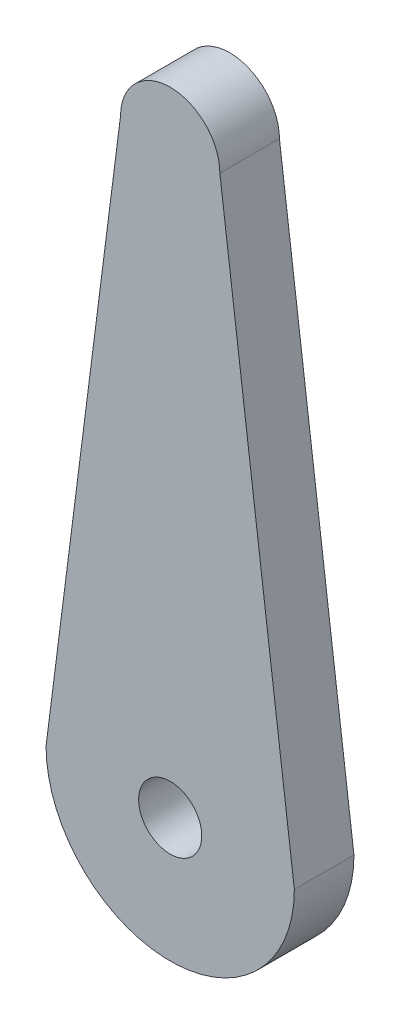
from build123d import *

# Parameters (mm, degrees)
BOSS_EXTRUDE1_DEPTH = 6
SKETCH2_R           = 3.175
CUT_EXTRUDE1_DEPTH  = 21


with BuildPart() as part:
    # Sketch1 → Boss-Extrude1 (new body)
    with BuildSketch(Plane(origin=(0, 0, 0), x_dir=(0, 1, 0), z_dir=(0, 0, 1))):
        with BuildLine():
            Line((0, 12.5), (58.7, 5))
            ThreePointArc((58.7, 5), (63.7, 0), (58.7, -5))
            Line((58.7, -5), (0, -12.5))
            ThreePointArc((0, -12.5), (-12.5, 0), (0, 12.5))
        make_face()
    extrude(amount=BOSS_EXTRUDE1_DEPTH)

    # Sketch2 → Cut-Extrude1 (cut)
    with BuildSketch(Plane.XY.offset(6)):
        Circle(SKETCH2_R)
    extrude(amount=-CUT_EXTRUDE1_DEPTH, mode=Mode.SUBTRACT)


solid = part.part
